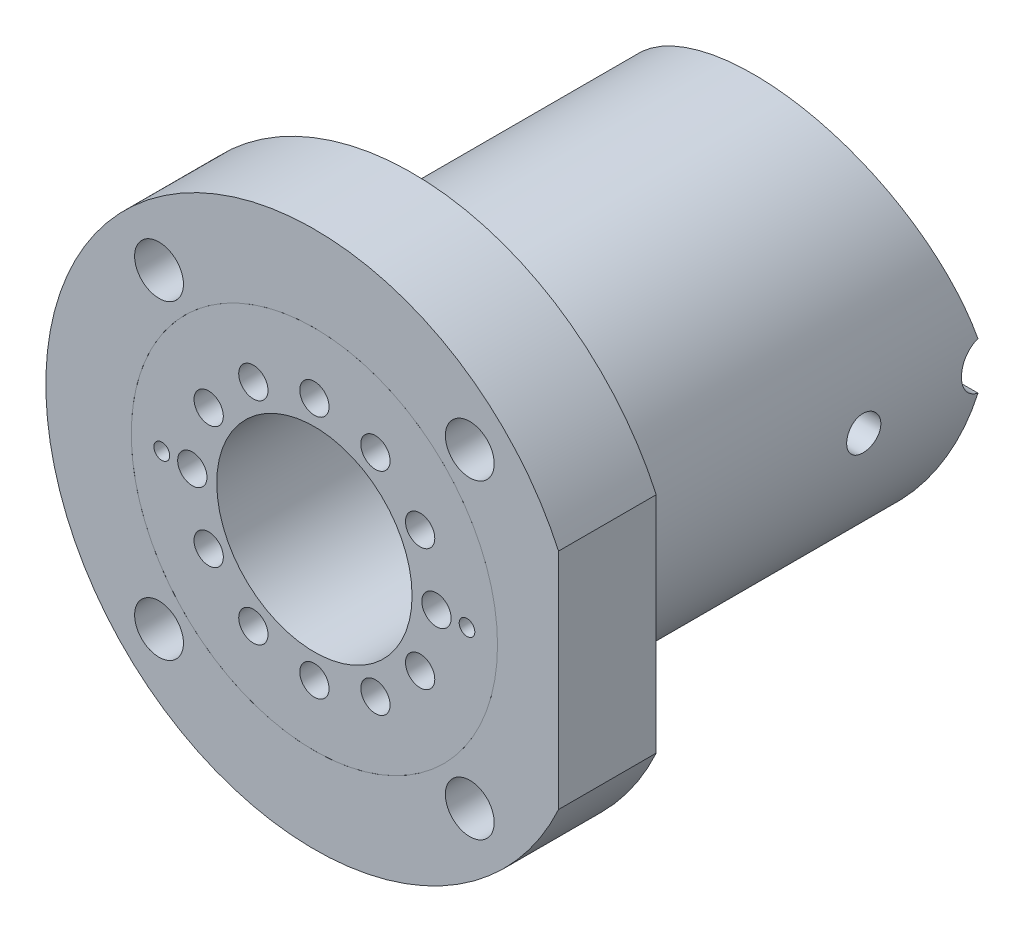
from build123d import *

# Parameters (mm, degrees)
SKETCH_1_R               = 7.5
SKETCH_1_R_2             = 4
SKETCH_1_R_3             = 0.6
SKETCH_1_R_4             = 0.325
SKETCH_1_R_5             = 0.32
EXTRUDE_1_DEPTH          = 20
CUT_EXTRUDE_1_DEPTH      = 23.638462845
SKETCH_3_R               = 7.5
EXTRUDE_2_DEPTH          = 4
SKETCH_5_R               = 1
CUT_EXTRUDE_2_DEPTH      = 4
CUT_EXTRUDE_3_DEPTH      = 10
CUT_EXTRUDE_3_DEPTH_BACK = 10
SKETCH_6_R               = 1
SKETCH_8_R               = 0.7
CUT_EXTRUDE_4_DEPTH      = 1.25
PATTERN_CIRCULAR_1_COUNT = 2


with BuildPart() as part:
    # 草图1 → 凸台-拉伸1 (new body)
    with BuildSketch(Plane.XY):
        Circle(SKETCH_1_R)
        Circle(SKETCH_1_R_2, mode=Mode.SUBTRACT)
        with Locations((0, 5)):
            Circle(SKETCH_1_R_3, mode=Mode.SUBTRACT)
        with Locations((2.5, 4.330127019)):
            Circle(SKETCH_1_R_3, mode=Mode.SUBTRACT)
        with Locations((4.330127019, 2.5)):
            Circle(SKETCH_1_R_3, mode=Mode.SUBTRACT)
        with Locations((5, 0)):
            Circle(SKETCH_1_R_3, mode=Mode.SUBTRACT)
        with Locations((4.330127019, -2.5)):
            Circle(SKETCH_1_R_3, mode=Mode.SUBTRACT)
        with Locations((2.5, -4.330127019)):
            Circle(SKETCH_1_R_3, mode=Mode.SUBTRACT)
        with Locations((0, -5)):
            Circle(SKETCH_1_R_3, mode=Mode.SUBTRACT)
        with Locations((-2.5, -4.330127019)):
            Circle(SKETCH_1_R_3, mode=Mode.SUBTRACT)
        with Locations((-4.330127019, -2.5)):
            Circle(SKETCH_1_R_3, mode=Mode.SUBTRACT)
        with Locations((-5, 0)):
            Circle(SKETCH_1_R_3, mode=Mode.SUBTRACT)
        with Locations((-4.330127019, 2.5)):
            Circle(SKETCH_1_R_3, mode=Mode.SUBTRACT)
        with Locations((-2.5, 4.330127019)):
            Circle(SKETCH_1_R_3, mode=Mode.SUBTRACT)
        with Locations((-6.25, 0)):
            Circle(SKETCH_1_R_4, mode=Mode.SUBTRACT)
        with Locations((6.25, 0)):
            Circle(SKETCH_1_R_5, mode=Mode.SUBTRACT)
    extrude(amount=EXTRUDE_1_DEPTH)

    # 草图2 → 切除-拉伸1 (cut, symmetric)
    with BuildSketch(Plane(origin=(0, 0, 0), x_dir=(0, 0, -1), z_dir=(1, 0, 0))):
        Polygon((0, 0), (-2.009618943, 7.5), (0, 7.5), align=None)
    cut_extrude_1 = extrude(amount=CUT_EXTRUDE_1_DEPTH, both=True, mode=Mode.SUBTRACT)

    # 镜向1: 切除-拉伸1 across plane
    add(cut_extrude_1.mirror(Plane.ZX), mode=Mode.SUBTRACT)

    # 草图6 → 切除-拉伸3 (cut, two sides: drawn at the far end of the back side and taken through both)
    with BuildSketch(Plane(origin=(0, 0, 0), x_dir=(0, 0, -1), z_dir=(1, 0, 0)).offset(-CUT_EXTRUDE_3_DEPTH_BACK)):
        Circle(SKETCH_6_R)
    extrude(amount=CUT_EXTRUDE_3_DEPTH + CUT_EXTRUDE_3_DEPTH_BACK, mode=Mode.SUBTRACT)

    # 草图8 → 切除-拉伸4 (cut)
    with BuildSketch(Plane.ZY.offset(7.5)):
        with Locations((5, 0)):
            Circle(SKETCH_8_R)
    cut_extrude_4 = extrude(amount=-CUT_EXTRUDE_4_DEPTH, mode=Mode.SUBTRACT)

    # 阵列(圆周)1: 切除-拉伸4 ×2 about axis
    pattern_circular_1_axis = Axis((0, 0, 20), (0, 0, -1))
    for i in range(1, PATTERN_CIRCULAR_1_COUNT):
        add(cut_extrude_4.rotate(pattern_circular_1_axis, i * 360 / PATTERN_CIRCULAR_1_COUNT), mode=Mode.SUBTRACT)


with BuildPart() as body_2:
    # 草图3 → 凸台-拉伸2 (new body)
    with BuildSketch(Plane.XY.offset(20)):
        with BuildLine():
            Line((10, 4.582575695), (10, -4.582575695))
            ThreePointArc((10, -4.582575695), (-11, 0), (10, 4.582575695))
        make_face()
        Circle(SKETCH_3_R, mode=Mode.SUBTRACT)
    extrude(amount=-EXTRUDE_2_DEPTH)

    # 草图5 → 切除-拉伸2 (cut)
    with BuildSketch(Plane.XY.offset(20)):
        with Locations((-6.363961031, 6.363961031)):
            Circle(SKETCH_5_R)
        with Locations((6.363961031, 6.363961031)):
            Circle(SKETCH_5_R)
        with Locations((-6.363961031, -6.363961031)):
            Circle(SKETCH_5_R)
        with Locations((6.363961031, -6.363961031)):
            Circle(SKETCH_5_R)
    extrude(amount=-CUT_EXTRUDE_2_DEPTH, mode=Mode.SUBTRACT)


solid = Compound([part.part, body_2.part])
